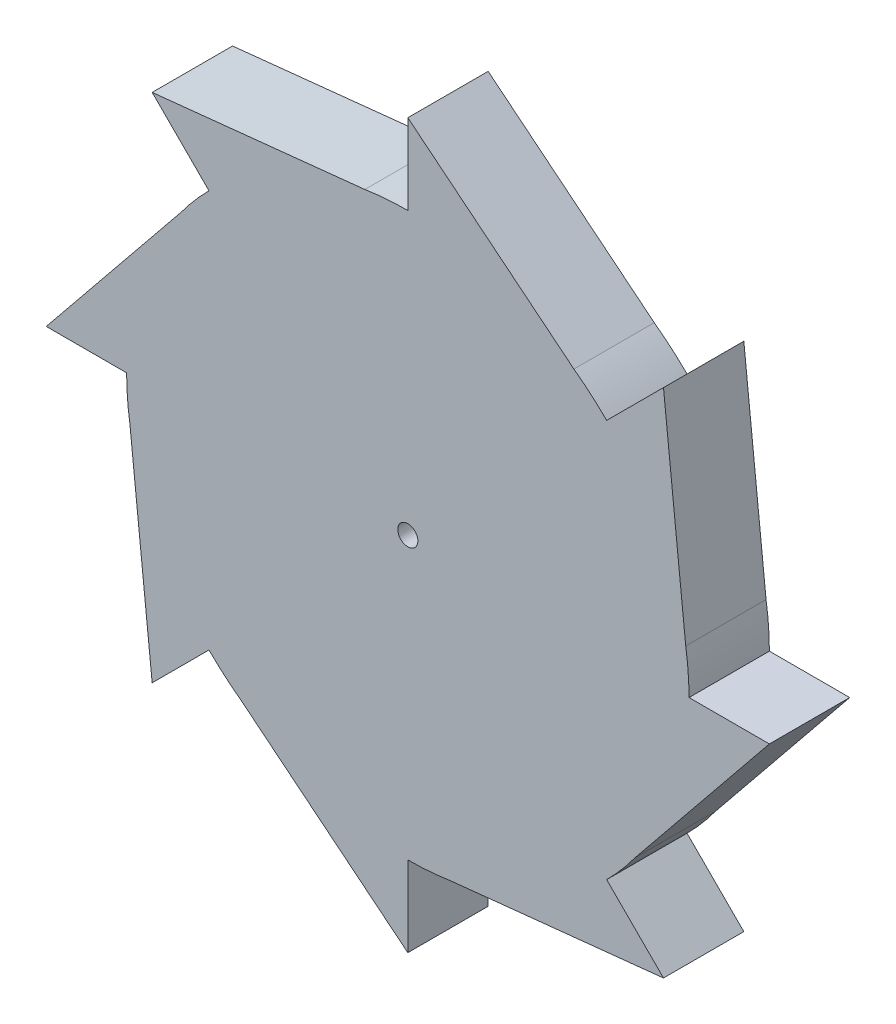
from build123d import *

# Parameters (mm, degrees)
BOSS_EXTRUDE1_DEPTH = 6.35
SKETCH2_R           = 0.79375
CUT_EXTRUDE1_DEPTH  = 41.907013457


with BuildPart() as part:
    # Sketch1 → Boss-Extrude1 (new body)
    with BuildSketch(Plane.XY):
        with BuildLine():
            Line((0, 22.225), (0, 28.575))
            Line((0, 28.575), (13.126483451, 17.934493503))
            ThreePointArc((13.126483451, 17.934493503), (14.463585172, 16.87469493), (15.715448212, 15.715448212))
            Line((15.715448212, 15.715448212), (20.205576272, 20.205576272))
            Line((20.205576272, 20.205576272), (21.963427435, 3.399776512))
            ThreePointArc((21.963427435, 3.399776512), (22.159510371, 1.70491206), (22.225, 0))
            Line((22.225, 0), (28.575, 0))
            Line((28.575, 0), (17.934493503, -13.126483451))
            ThreePointArc((17.934493503, -13.126483451), (16.87469493, -14.463585172), (15.715448212, -15.715448212))
            Line((15.715448212, -15.715448212), (20.205576272, -20.205576272))
            Line((20.205576272, -20.205576272), (3.399776512, -21.963427435))
            ThreePointArc((3.399776512, -21.963427435), (1.70491206, -22.159510371), (0, -22.225))
            Line((0, -22.225), (0, -28.575))
            Line((0, -28.575), (-13.126483451, -17.934493503))
            ThreePointArc((-13.126483451, -17.934493503), (-14.463585172, -16.87469493), (-15.715448212, -15.715448212))
            Line((-15.715448212, -15.715448212), (-20.205576272, -20.205576272))
            Line((-20.205576272, -20.205576272), (-21.963427435, -3.399776512))
            ThreePointArc((-21.963427435, -3.399776512), (-22.159510371, -1.70491206), (-22.225, 0))
            Line((-22.225, 0), (-28.575, 0))
            Line((-28.575, 0), (-17.934493503, 13.126483451))
            ThreePointArc((-17.934493503, 13.126483451), (-16.87469493, 14.463585172), (-15.715448212, 15.715448212))
            Line((-15.715448212, 15.715448212), (-20.205576272, 20.205576272))
            Line((-20.205576272, 20.205576272), (-3.399776512, 21.963427435))
            ThreePointArc((-3.399776512, 21.963427435), (-1.70491206, 22.159510371), (0, 22.225))
        make_face()
    extrude(amount=BOSS_EXTRUDE1_DEPTH)

    # Sketch2 → Cut-Extrude1 (cut, through all)
    with BuildSketch(Plane.XY.offset(6.35)):
        Circle(SKETCH2_R)
    extrude(amount=-CUT_EXTRUDE1_DEPTH, mode=Mode.SUBTRACT)


solid = part.part
